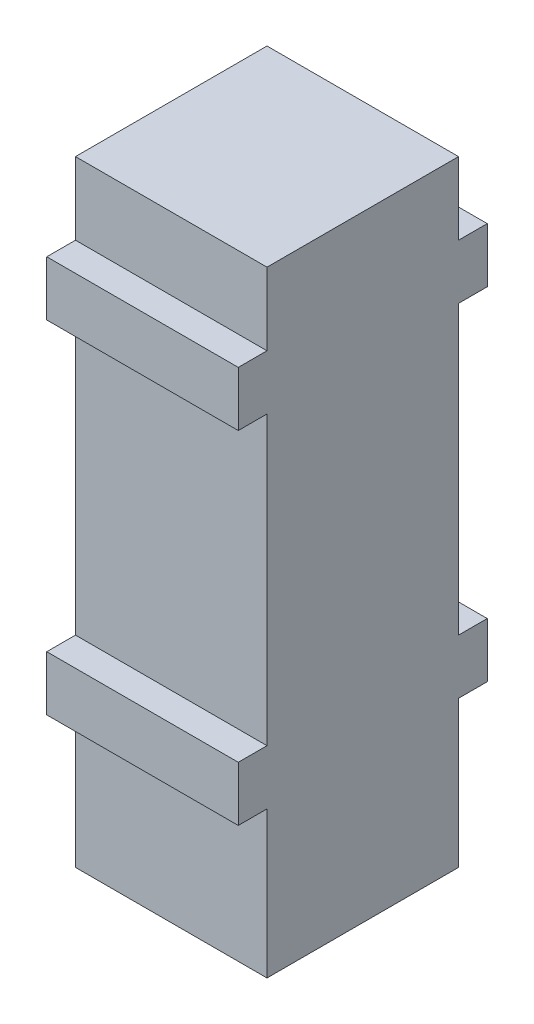
from build123d import *

# Parameters (mm, degrees)
SKETCH1_W           = 14
SKETCH1_H           = 14
BOSS_EXTRUDE1_DEPTH = 45
SKETCH2_W           = 14
SKETCH2_H           = 4
BOSS_EXTRUDE2_DEPTH = 2.1


with BuildPart() as part:
    # Sketch1 → Boss-Extrude1 (new body)
    with BuildSketch(Plane(origin=(0, 0, 0), x_dir=(1, 0, 0), z_dir=(0, 1, 0))):
        with Locations((7, 7)):
            Rectangle(SKETCH1_W, SKETCH1_H)
    extrude(amount=BOSS_EXTRUDE1_DEPTH)

    # Sketch2 → Boss-Extrude2 (add)
    with BuildSketch(Plane(origin=(0, 0, -14), x_dir=(-1, 0, 0), z_dir=(0, 0, -1))):
        with Locations((-7, 37.706344583)):
            Rectangle(SKETCH2_W, SKETCH2_H)
        with Locations((-7, 12.706344583)):
            Rectangle(SKETCH2_W, SKETCH2_H)
    boss_extrude2 = extrude(amount=BOSS_EXTRUDE2_DEPTH)

    # Mirror1: Boss-Extrude2 across plane
    add(boss_extrude2.mirror(Plane.XY.offset(-7)))


solid = part.part
